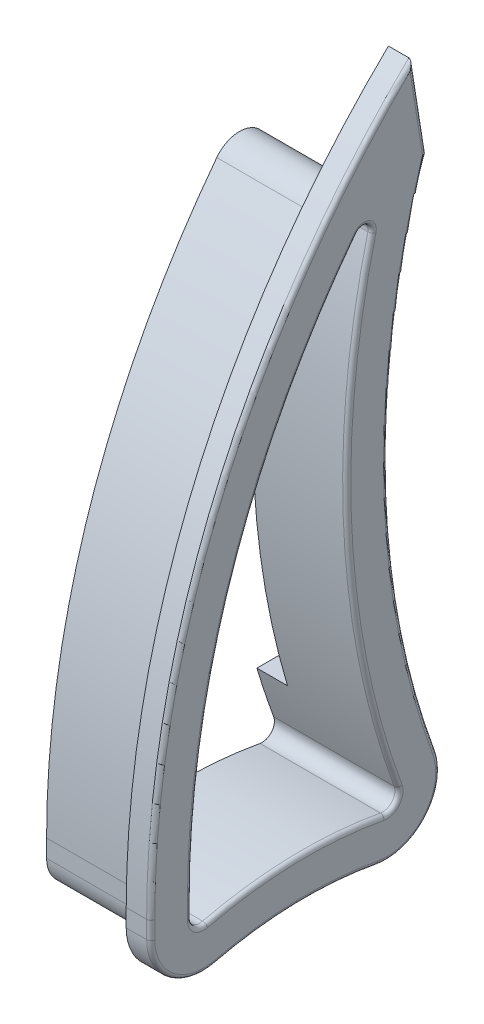
from build123d import *

# Parameters (mm, degrees)
BOSS_EXTRUDE1_DEPTH         = 1.524
KES_EKSTR_ZYON1_DEPTH       = 2.54
RADYUS1_R                   = 0.508
Y_KSEKLIK_EKSTR_ZYON1_DEPTH = 6.223
Y_KSEKLIK_EKSTR_ZYON2_START = -1.524
Y_KSEKLIK_EKSTR_ZYON2_DEPTH = 1.524
IZIM5_W                     = 1.905
IZIM5_H                     = 23.876
KES_EKSTR_ZYON2_DEPTH       = 9.779
RADYUS2_R                   = 0.254


with BuildPart() as part:
    # Sketch2 → Boss-Extrude1 (new body)
    with BuildSketch(Plane(origin=(0, 0, 0), x_dir=(0, 0, -1), z_dir=(1, 0, 0))):
        with BuildLine():
            Line((-10.16, 10.851579944), (-10.16, 9.756379827))
            ThreePointArc((-10.16, 9.756379827), (-8.902698353, 7.16361824), (-6.088278228, 6.54534691))
            ThreePointArc((-6.088278228, 6.54534691), (-1.097578785, 7.201770952), (3.920718614, 6.808496661))
            ThreePointArc((3.920718614, 6.808496661), (7.044965017, 7.926917254), (7.619757818, 11.195157369))
            ThreePointArc((7.619757818, 11.195157369), (4.593793799, 26.843864795), (6.687175028, 42.644379261))
            ThreePointArc((6.687175028, 42.644379261), (5.465660141, 45.611386582), (2.312998216, 45.014767901))
            ThreePointArc((2.312998216, 45.014767901), (-6.944233805, 29.036045126), (-10.16, 10.851579944))
        make_face()
    extrude(amount=BOSS_EXTRUDE1_DEPTH)

    # Sketch3 → Kes-Ekstrüzyon1 (cut)
    with BuildSketch(Plane(origin=(1.524, 0, 0), x_dir=(0, 0, -1), z_dir=(1, 0, 0))):
        with BuildLine():
            Line((-7.62, 10.851579944), (-7.62, 9.756379827))
            ThreePointArc((-7.62, 9.756379827), (-7.329853466, 9.15805023), (-6.680371899, 9.015372231))
            ThreePointArc((-6.680371899, 9.015372231), (-1.164335672, 9.74089354), (4.382203558, 9.306221955))
            ThreePointArc((4.382203558, 9.306221955), (5.103183497, 9.564319015), (5.23582799, 10.318528273))
            ThreePointArc((5.23582799, 10.318528273), (2.05490982, 26.768577734), (4.25548932, 43.378207999))
            ThreePointArc((4.25548932, 43.378207999), (-4.558282485, 28.164933022), (-7.62, 10.851579944))
        make_face()
    extrude(amount=-KES_EKSTR_ZYON1_DEPTH, mode=Mode.SUBTRACT)

    # Radyus1
    radyus1_edges = [part.edges().sort_by_distance(p)[0] for p in [
        (0.762, 43.378207999, -4.25548932),
    ]]
    fillet(radyus1_edges, radius=RADYUS1_R)

    # Çizim3 → Yükseklik-Ekstrüzyon1 (add)
    with BuildSketch(Plane.ZY):
        with BuildLine():
            Line((8.89, 9.756379827), (8.89, 10.851579944))
            ThreePointArc((8.89, 10.851579944), (6.172491894, 27.401227257), (-1.694641367, 42.212840631))
            ThreePointArc((-1.694641367, 42.212840631), (-3.87996363, 42.737551733), (-4.833471032, 40.702415677))
            ThreePointArc((-4.833471032, 40.702415677), (-3.373946338, 25.609481831), (-6.427792904, 10.756842821))
            ThreePointArc((-6.427792904, 10.756842821), (-6.074074257, 8.745618135), (-4.151461086, 8.057359308))
            ThreePointArc((-4.151461086, 8.057359308), (1.130957229, 8.471332246), (6.384325063, 7.78035957))
            ThreePointArc((6.384325063, 7.78035957), (8.116275909, 8.160834235), (8.89, 9.756379827))
        make_face()
        with BuildLine():
            Line((7.62, 10.851579944), (7.62, 9.756379827))
            ThreePointArc((7.62, 9.756379827), (7.329853466, 9.15805023), (6.680371899, 9.015372231))
            ThreePointArc((6.680371899, 9.015372231), (1.164335672, 9.74089354), (-4.382203558, 9.306221955))
            ThreePointArc((-4.382203558, 9.306221955), (-5.103183497, 9.564319015), (-5.23582799, 10.318528273))
            ThreePointArc((-5.23582799, 10.318528273), (-2.10574247, 25.541961828), (-3.601704042, 41.011689155))
            ThreePointArc((-3.601704042, 41.011689155), (-3.329273356, 41.593156599), (-2.704895567, 41.443239142))
            ThreePointArc((-2.704895567, 41.443239142), (4.96917921, 26.995100943), (7.62, 10.851579944))
        make_face(mode=Mode.SUBTRACT)
    extrude(amount=Y_KSEKLIK_EKSTR_ZYON1_DEPTH)

    # Sketch5 → Yükseklik-Ekstrüzyon2 (add)
    with BuildSketch(Plane(origin=(1.524, 0, 0), x_dir=(0, 0, -1), z_dir=(1, 0, 0)).offset(Y_KSEKLIK_EKSTR_ZYON2_START)):
        with BuildLine():
            Line((7.009110806, 43.67080126), (6.148171078, 49.106560771))
            ThreePointArc((6.148171078, 49.106560771), (3.588810081, 46.474083877), (1.217761815, 43.67080126))
            Line((1.217761815, 43.67080126), (6.534669415, 42.12894069))
            ThreePointArc((6.534669415, 42.12894069), (6.765621389, 42.901799905), (7.009110806, 43.67080126))
        make_face()
    extrude(amount=Y_KSEKLIK_EKSTR_ZYON2_DEPTH)

    # Çizim5 → Kes-Ekstrüzyon2 (cut)
    with BuildSketch(Plane.XY):
        with Locations((-5.2705, 25.4)):
            Rectangle(IZIM5_W, IZIM5_H)
    extrude(amount=-KES_EKSTR_ZYON2_DEPTH, mode=Mode.SUBTRACT)

    # Radyus2
    radyus2_edges = [part.edges().sort_by_distance(p)[0] for p in [
        (1.524, 31.644607634, 5.912857567),
        (1.524, 10.303979886, 10.16),
        (1.524, 7.16361824, 8.902698353),
        (1.524, 7.201770952, 1.097578785),
        (1.524, 7.926917254, -7.044965017),
        (1.524, 9.74089354, 1.164335672),
        (1.524, 10.303979886, 7.62),
        (1.524, 9.15805023, 7.329853466),
        (1.524, 9.564319015, -5.103183497),
        (1.524, 27.381577524, -4.580766254),
        (1.524, 26.995100943, 4.96917921),
        (1.524, 25.541961828, -2.10574247),
        (1.524, 41.593156599, -3.329273357),
        (1.524, 46.388681016, -6.578640942),
    ]]
    fillet(radyus2_edges, radius=RADYUS2_R)


solid = part.part
